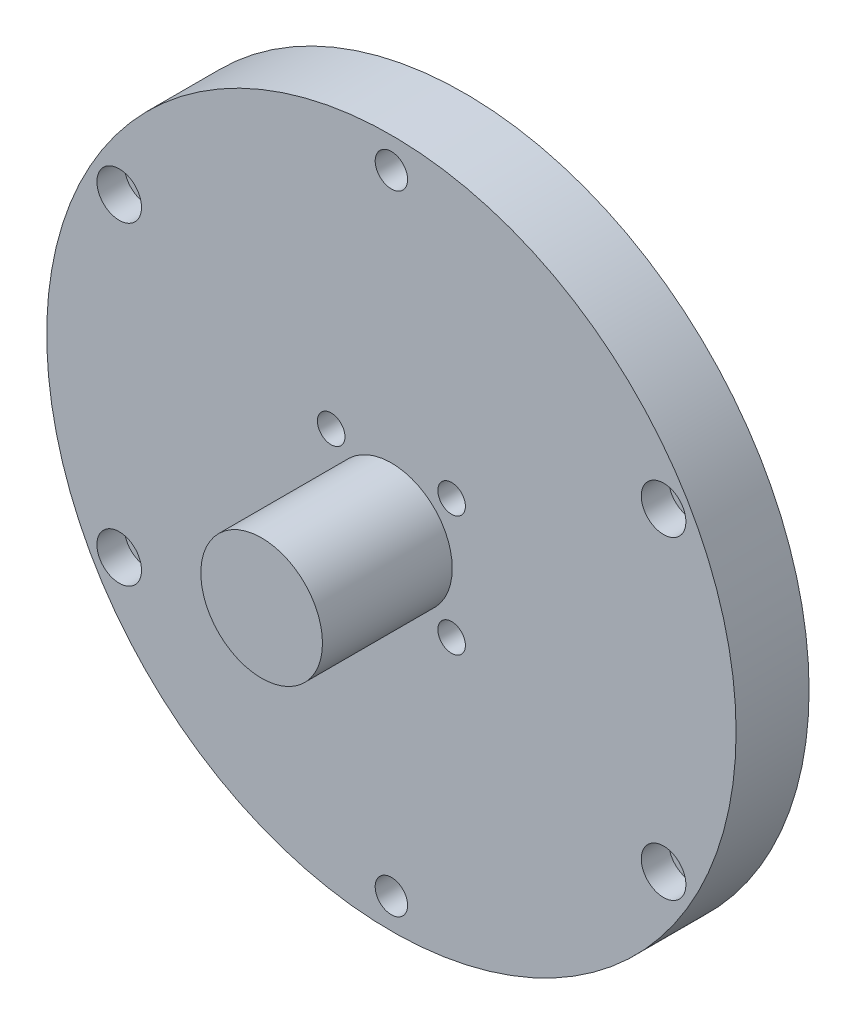
from build123d import *

# Parameters (mm, degrees)
SKETCH_1_R                = 85
SKETCH_1_R_2              = 4
SKETCH_1_R_3              = 3
EXTRUDE_1_DEPTH           = 18
HOLE_WIZARD_1_D           = 6.6
HOLE_WIZARD_1_CBORE_D     = 11
HOLE_WIZARD_1_CBORE_DEPTH = 6.8
HOLE_WIZARD_M8_1_D        = 6.8
SKETCH_6_R                = 15
EXTRUDE_2_DEPTH           = 32


with BuildPart() as part:
    # 草图1 → 凸台-拉伸1 (new body)
    with BuildSketch(Plane.XY):
        Circle(SKETCH_1_R)
        with Locations((0, 77.5)):
            Circle(SKETCH_1_R_2, mode=Mode.SUBTRACT)
        with Locations((67.116968793, 38.75)):
            Circle(SKETCH_1_R_2, mode=Mode.SUBTRACT)
        with Locations((67.116968793, -38.75)):
            Circle(SKETCH_1_R_2, mode=Mode.SUBTRACT)
        with Locations((0, -77.5)):
            Circle(SKETCH_1_R_2, mode=Mode.SUBTRACT)
        with Locations((-67.116968793, -38.75)):
            Circle(SKETCH_1_R_2, mode=Mode.SUBTRACT)
        with Locations((-67.116968793, 38.75)):
            Circle(SKETCH_1_R_2, mode=Mode.SUBTRACT)
        with Locations((-14.849242405, 14.849242405)):
            Circle(SKETCH_1_R_3, mode=Mode.SUBTRACT)
        with Locations((14.849242405, 14.849242405)):
            Circle(SKETCH_1_R_3, mode=Mode.SUBTRACT)
        with Locations((14.849242405, -14.849242405)):
            Circle(SKETCH_1_R_3, mode=Mode.SUBTRACT)
        with Locations((-14.849242405, -14.849242405)):
            Circle(SKETCH_1_R_3, mode=Mode.SUBTRACT)
    extrude(amount=EXTRUDE_1_DEPTH)

    # 打孔尺寸(%根据)内六角圆柱头螺钉的类型1 (through all)
    with Locations(Plane.XY.offset(18)):
        with Locations((-67.116968793, 38.75), (67.116968793, 38.75), (67.116968793, -38.75), (-67.116968793, -38.75)):
            CounterBoreHole(HOLE_WIZARD_1_D / 2, HOLE_WIZARD_1_CBORE_D / 2, HOLE_WIZARD_1_CBORE_DEPTH)

    # M8 螺纹孔1 (through all)
    with Locations(Plane.XY.offset(18)):
        with Locations((-14.849242405, 14.849242405), (14.849242405, 14.849242405), (14.849242405, -14.849242405), (-14.849242405, -14.849242405)):
            Hole(HOLE_WIZARD_M8_1_D / 2)

    # 草图6 → 凸台-拉伸2 (add)
    with BuildSketch(Plane.XY.offset(18)):
        Circle(SKETCH_6_R)
    extrude(amount=EXTRUDE_2_DEPTH)


solid = part.part
